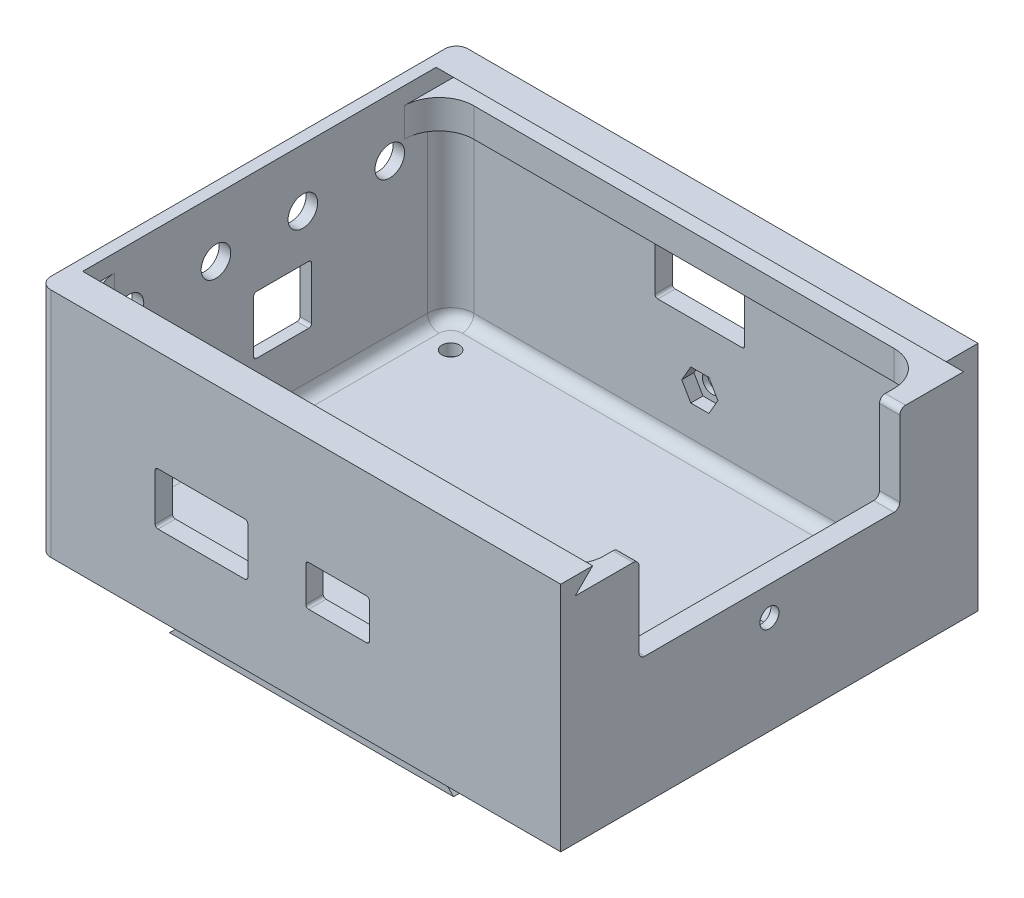
from build123d import *

# Parameters (mm, degrees)
SKETCH1_W                 = 90
SKETCH1_H                 = 72
BOSS_EXTRUDE1_DEPTH       = 40
SHELL1_T                  = -2
SHELL1_THICKNESS_2_FACE_W = 86
SHELL1_THICKNESS_2_FACE_H = 38
SHELL1_THICKNESS_2_DEPTH  = 1
SHELL1_THICKNESS_3_FACE_W = 86
SHELL1_THICKNESS_3_FACE_H = 38
SHELL1_THICKNESS_3_DEPTH  = 1
SHELL1_THICKNESS_4_FACE_W = 66
SHELL1_THICKNESS_4_FACE_H = 38
SHELL1_THICKNESS_4_DEPTH  = 1.5
SKETCH2_R                 = 1.5
CUT_EXTRUDE1_DEPTH        = 2
CUT_EXTRUDE2_DEPTH        = 88
BOSS_EXTRUDE2_REACH       = 103.874
SKETCH4_W                 = 2
SKETCH4_H                 = 5
SKETCH5_R                 = 1.65
SKETCH5_W                 = 45
SKETCH5_H                 = 15
CUT_EXTRUDE3_DEPTH        = 3.5
CUT_EXTRUDE4_DEPTH        = 2.1
CUT_EXTRUDE5_REACH        = 106.862
SKETCH7_R                 = 2.55
SKETCH7_W                 = 10
SKETCH7_H                 = 10
SKETCH8_W                 = 16
SKETCH8_H                 = 9
SKETCH8_W_2               = 11
SKETCH8_H_2               = 7
CUT_EXTRUDE6_DEPTH        = 3
BOSS_EXTRUDE3_DEPTH       = 70
SKETCH10_R                = 1.65
SKETCH10_W                = 15.5
SKETCH10_H                = 9.5
CUT_EXTRUDE7_DEPTH        = 3
CUT_EXTRUDE8_DEPTH        = 2.1
FILLET3_R                 = 1
FILLET4_R                 = 0.5
FILLET5_R                 = 0.5
FILLET6_R                 = 0.5
FILLET7_R                 = 6
FILLET8_R                 = 4
FILLET9_R                 = 2
FILLET10_R                = 2


with BuildPart() as part:
    # Sketch1 → Boss-Extrude1 (new body)
    with BuildSketch(Plane(origin=(0, 0, 0), x_dir=(1, 0, 0), z_dir=(0, 1, 0))):
        Rectangle(SKETCH1_W, SKETCH1_H)
    extrude(amount=BOSS_EXTRUDE1_DEPTH)

    # Shell1
    shell1_openings = [part.faces().sort_by_distance(p)[0] for p in [
        (0, 40, 0),
    ]]
    offset(amount=SHELL1_T, openings=shell1_openings, kind=Kind.INTERSECTION)

    # Shell1 thickness 2 face (on inner face of the shell) → Shell1 thickness 2 (add)
    with BuildSketch(Plane(origin=(0, 21, 34), x_dir=(1, 0, 0), z_dir=(0, 0, 1))):
        Rectangle(SHELL1_THICKNESS_2_FACE_W, SHELL1_THICKNESS_2_FACE_H)
    extrude(amount=-SHELL1_THICKNESS_2_DEPTH)

    # Shell1 thickness 3 face (on inner face of the shell) → Shell1 thickness 3 (add)
    with BuildSketch(Plane(origin=(0, 21, -34), x_dir=(-1, 0, 0), z_dir=(0, 0, -1))):
        Rectangle(SHELL1_THICKNESS_3_FACE_W, SHELL1_THICKNESS_3_FACE_H)
    extrude(amount=-SHELL1_THICKNESS_3_DEPTH)

    # Shell1 thickness 4 face (on inner face of the shell) → Shell1 thickness 4 (add)
    with BuildSketch(Plane(origin=(43, 21, 0), x_dir=(0, 0, 1), z_dir=(1, 0, 0))):
        Rectangle(SHELL1_THICKNESS_4_FACE_W, SHELL1_THICKNESS_4_FACE_H)
    extrude(amount=-SHELL1_THICKNESS_4_DEPTH)

    # Sketch2 → Cut-Extrude1 (cut)
    with BuildSketch(Plane(origin=(0, 2, 0), x_dir=(1, 0, 0), z_dir=(0, 1, 0))):
        with Locations(Location((37.5, 27.5, 0), (0, 0, 270))):
            Circle(SKETCH2_R)
        with Locations(Location((-37.5, 27.5, 0), (0, 0, 270))):
            Circle(SKETCH2_R)
        with Locations(Location((-37.5, -27.5, 0), (0, 0, 270))):
            Circle(SKETCH2_R)
        with Locations(Location((37.5, -27.5, 0), (0, 0, 270))):
            Circle(SKETCH2_R)
    extrude(amount=-CUT_EXTRUDE1_DEPTH, mode=Mode.SUBTRACT)

    # Sketch3 → Cut-Extrude2 (cut)
    with BuildSketch(Plane(origin=(45, 0, 0), x_dir=(0, 0, -1), z_dir=(1, 0, 0))):
        Polygon((-30.5, 40), (-33.5, 37), (33.5, 37), (30.5, 40), align=None)
    extrude(amount=-CUT_EXTRUDE2_DEPTH, mode=Mode.SUBTRACT)

    # Sketch4 → Boss-Extrude2 (add, up to next)
    with BuildSketch(Plane.ZY.offset(-41.5), mode=Mode.PRIVATE) as boss_extrude2_sk1:
        Polygon((30.5, 40), (33, 37.5), (33, 40), align=None)
    boss_extrude2_tool1 = extrude(boss_extrude2_sk1.sketch, amount=BOSS_EXTRUDE2_REACH, mode=Mode.PRIVATE) - part.part
    # Sketch4 → Boss-Extrude2 (add, up to next)
    with BuildSketch(Plane.ZY.offset(-41.5), mode=Mode.PRIVATE) as boss_extrude2_sk2:
        Polygon((-33, 37.5), (-30.5, 40), (-33, 40), align=None)
    boss_extrude2_tool2 = extrude(boss_extrude2_sk2.sketch, amount=BOSS_EXTRUDE2_REACH, mode=Mode.PRIVATE) - part.part
    # Sketch4 → Boss-Extrude2 (add, up to next)
    with BuildSketch(Plane.ZY.offset(-41.5), mode=Mode.PRIVATE) as boss_extrude2_sk3:
        with Locations((-32, 34.5)):
            Rectangle(SKETCH4_W, SKETCH4_H)
    boss_extrude2_tool3 = extrude(boss_extrude2_sk3.sketch, amount=BOSS_EXTRUDE2_REACH, mode=Mode.PRIVATE) - part.part
    # Sketch4 → Boss-Extrude2 (add, up to next)
    with BuildSketch(Plane.ZY.offset(-41.5), mode=Mode.PRIVATE) as boss_extrude2_sk4:
        with Locations((32, 34.5)):
            Rectangle(SKETCH4_W, SKETCH4_H)
    boss_extrude2_tool4 = extrude(boss_extrude2_sk4.sketch, amount=BOSS_EXTRUDE2_REACH, mode=Mode.PRIVATE) - part.part
    add(boss_extrude2_tool1.solids().sort_by_distance((41.5, 39.166667, 32.166667))[0])
    add(boss_extrude2_tool2.solids().sort_by_distance((41.5, 39.166667, -32.166667))[0])
    add(boss_extrude2_tool3.solids().sort_by_distance((41.5, 34.5, -32))[0])
    add(boss_extrude2_tool4.solids().sort_by_distance((41.5, 34.5, 32))[0])

    # Sketch5 → Cut-Extrude3 (cut)
    with BuildSketch(Plane(origin=(45, 0, 0), x_dir=(0, 0, -1), z_dir=(1, 0, 0))):
        with Locations((0, 17)):
            Circle(SKETCH5_R)
        with Locations((0, 29.5)):
            Rectangle(SKETCH5_W, SKETCH5_H)
    extrude(amount=-CUT_EXTRUDE3_DEPTH, mode=Mode.SUBTRACT)

    # Sketch6 → Cut-Extrude4 (cut)
    with BuildSketch(Plane.ZY.offset(-41.5)):
        Polygon((3.117691454, 17), (1.558845727, 19.7), (-1.558845727, 19.7), (-3.117691454, 17), (-1.558845727, 14.3), (1.558845727, 14.3), align=None)
    extrude(amount=-CUT_EXTRUDE4_DEPTH, mode=Mode.SUBTRACT)

    # Sketch7 → Cut-Extrude5 (cut, up to next)
    with BuildSketch(Plane.ZY.offset(45), mode=Mode.PRIVATE) as cut_extrude5_sk1:
        with Locations((-22.5, 30)):
            Circle(SKETCH7_R)
    cut_extrude5_tool1 = extrude(cut_extrude5_sk1.sketch, amount=-CUT_EXTRUDE5_REACH, mode=Mode.PRIVATE) & part.part
    # Sketch7 → Cut-Extrude5 (cut, up to next)
    with BuildSketch(Plane.ZY.offset(45), mode=Mode.PRIVATE) as cut_extrude5_sk2:
        with Locations((-7.5, 30)):
            Circle(SKETCH7_R)
    cut_extrude5_tool2 = extrude(cut_extrude5_sk2.sketch, amount=-CUT_EXTRUDE5_REACH, mode=Mode.PRIVATE) & part.part
    # Sketch7 → Cut-Extrude5 (cut, up to next)
    with BuildSketch(Plane.ZY.offset(45), mode=Mode.PRIVATE) as cut_extrude5_sk3:
        with Locations((7.5, 30)):
            Circle(SKETCH7_R)
    cut_extrude5_tool3 = extrude(cut_extrude5_sk3.sketch, amount=-CUT_EXTRUDE5_REACH, mode=Mode.PRIVATE) & part.part
    # Sketch7 → Cut-Extrude5 (cut, up to next)
    with BuildSketch(Plane.ZY.offset(45), mode=Mode.PRIVATE) as cut_extrude5_sk4:
        with Locations((22.5, 30)):
            Circle(SKETCH7_R)
    cut_extrude5_tool4 = extrude(cut_extrude5_sk4.sketch, amount=-CUT_EXTRUDE5_REACH, mode=Mode.PRIVATE) & part.part
    # Sketch7 → Cut-Extrude5 (cut, up to next)
    with BuildSketch(Plane.ZY.offset(45), mode=Mode.PRIVATE) as cut_extrude5_sk5:
        with Locations((-4, 17)):
            Rectangle(SKETCH7_W, SKETCH7_H)
    cut_extrude5_tool5 = extrude(cut_extrude5_sk5.sketch, amount=-CUT_EXTRUDE5_REACH, mode=Mode.PRIVATE) & part.part
    add(cut_extrude5_tool1.solids().sort_by_distance((-45, 30, -22.5))[0], mode=Mode.SUBTRACT)
    add(cut_extrude5_tool2.solids().sort_by_distance((-45, 30, -7.5))[0], mode=Mode.SUBTRACT)
    add(cut_extrude5_tool3.solids().sort_by_distance((-45, 30, 7.5))[0], mode=Mode.SUBTRACT)
    add(cut_extrude5_tool4.solids().sort_by_distance((-45, 30, 22.5))[0], mode=Mode.SUBTRACT)
    add(cut_extrude5_tool5.solids().sort_by_distance((-45, 17, -4))[0], mode=Mode.SUBTRACT)

    # Sketch8 → Cut-Extrude6 (cut)
    with BuildSketch(Plane.XY.offset(36)):
        with Locations((-17, 18)):
            Rectangle(SKETCH8_W, SKETCH8_H)
        with Locations((6.5, 18)):
            Rectangle(SKETCH8_W_2, SKETCH8_H_2)
    extrude(amount=-CUT_EXTRUDE6_DEPTH, mode=Mode.SUBTRACT)

    # Sketch9 → Boss-Extrude3 (add)
    with BuildSketch(Plane.XY.offset(-36)):
        Polygon((21.517157288, 0), (-21.517157288, 0), (-24.517157288, -3), (24.517157288, -3), align=None)
    extrude(amount=BOSS_EXTRUDE3_DEPTH)

    # Sketch10 → Cut-Extrude7 (cut)
    with BuildSketch(Plane(origin=(0, 0, -36), x_dir=(-1, 0, 0), z_dir=(0, 0, -1))):
        with Locations((0, 12)):
            Circle(SKETCH10_R)
        with Locations((0, 26.75)):
            Rectangle(SKETCH10_W, SKETCH10_H)
    extrude(amount=-CUT_EXTRUDE7_DEPTH, mode=Mode.SUBTRACT)

    # Sketch11 → Cut-Extrude8 (cut)
    with BuildSketch(Plane.XY.offset(-33)):
        Polygon((1.558845727, 14.7), (-1.558845727, 14.7), (-3.117691454, 12), (-1.558845727, 9.3), (1.558845727, 9.3), (3.117691454, 12), align=None)
    extrude(amount=-CUT_EXTRUDE8_DEPTH, mode=Mode.SUBTRACT)

    # Fillet3
    fillet3_edges = [part.edges().sort_by_distance(p)[0] for p in [
        (43.25, 37, 22.5),
        (43.25, 22, 22.5),
        (43.25, 22, -22.5),
        (43.25, 37, -22.5),
    ]]
    fillet(fillet3_edges, radius=FILLET3_R)

    # Fillet4
    fillet4_edges = [part.edges().sort_by_distance(p)[0] for p in [
        (-44, 22, -9),
        (-44, 12, -9),
        (-44, 12, 1),
        (-44, 22, 1),
    ]]
    fillet(fillet4_edges, radius=FILLET4_R)

    # Fillet5
    fillet5_edges = [part.edges().sort_by_distance(p)[0] for p in [
        (-25, 22.5, 34.5),
        (-25, 13.5, 34.5),
        (-9, 13.5, 34.5),
        (-9, 22.5, 34.5),
        (1, 21.5, 34.5),
        (1, 14.5, 34.5),
        (12, 14.5, 34.5),
        (12, 21.5, 34.5),
    ]]
    fillet(fillet5_edges, radius=FILLET5_R)

    # Fillet6
    fillet6_edges = [part.edges().sort_by_distance(p)[0] for p in [
        (7.75, 31.5, -34.5),
        (7.75, 22, -34.5),
        (-7.75, 22, -34.5),
        (-7.75, 31.5, -34.5),
    ]]
    fillet(fillet6_edges, radius=FILLET6_R)

    # Fillet7
    fillet7_edges = [part.edges().sort_by_distance(p)[0] for p in [
        (-43, 34.5, 31),
        (41.5, 34.5, 31),
        (-43, 34.5, -31),
        (41.5, 34.5, -31),
    ]]
    fillet(fillet7_edges, radius=FILLET7_R)

    # Fillet8
    fillet8_edges = [part.edges().sort_by_distance(p)[0] for p in [
        (41.5, 17, 33),
        (-43, 17, 33),
        (-43, 17, -33),
        (41.5, 17, -33),
    ]]
    fillet(fillet8_edges, radius=FILLET8_R)

    # Fillet9
    fillet9_edges = [part.edges().sort_by_distance(p)[0] for p in [
        (-0.75, 2, -33),
        (-43, 2, 0),
        (-0.75, 2, 33),
        (41.5, 2, 0),
        (-41.828427125, 2, 31.828427125),
        (40.328427125, 2, 31.828427125),
        (40.328427125, 2, -31.828427125),
        (-41.828427125, 2, -31.828427125),
    ]]
    fillet(fillet9_edges, radius=FILLET9_R)

    # Fillet10
    fillet10_edges = [part.edges().sort_by_distance(p)[0] for p in [
        (-45, 20, -36),
        (-45, 20, 36),
    ]]
    fillet(fillet10_edges, radius=FILLET10_R)


solid = part.part
